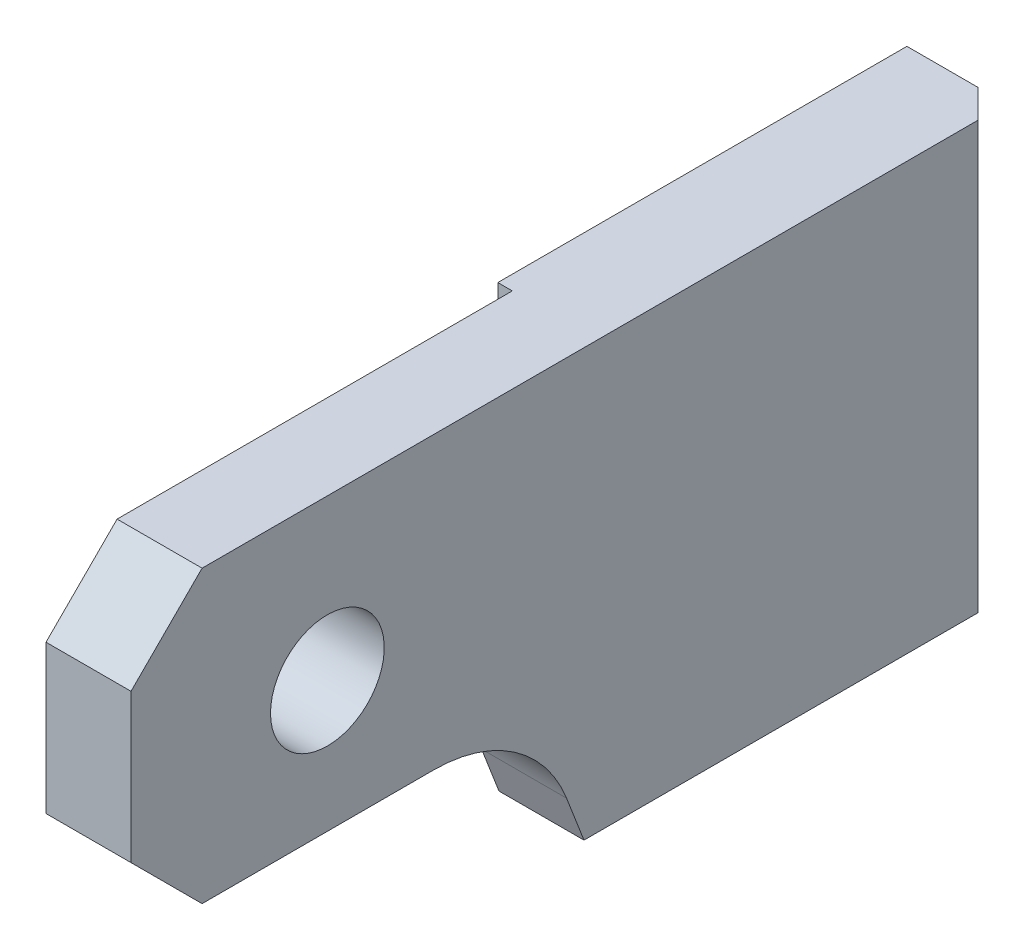
from build123d import *

# Parameters (mm, degrees)
EXTRUDE_1_DEPTH       = 7
FILLET_1_R            = 10
CHAMFER_1_SIZE        = 5
CHAMFER_2_SIZE        = 2
SKETCH_3_R            = 4
CUT_EXTRUDE_2_DEPTH   = 98.811761039
SKETCH_5_W            = 7.308921848
SKETCH_5_H            = 35.296607786
CUT_EXTRUDE_2_2_DEPTH = 98.534926302


with BuildPart() as part:
    # Эскиз1 → Вытянуть1 (new body)
    with BuildSketch(Plane(origin=(0, 0, 0), x_dir=(0, 0, -1), z_dir=(1, 0, 0))):
        Polygon((62.822655934, -30.891323454), (59.120013374, -21.327683482), (30.956731402, -21.327683482), (30.956731402, -0.888409733), (92.539330922, -0.888409733), (92.539330922, -30.896809382), align=None)
    extrude(amount=-EXTRUDE_1_DEPTH)

    # Скругление1
    fillet_1_edges = [part.edges().sort_by_distance(p)[0] for p in [
        (-3.5, -21.327683482, -59.120013374),
    ]]
    fillet(fillet_1_edges, radius=FILLET_1_R)

    # Фаска1
    chamfer_1_edges = [part.edges().sort_by_distance(p)[0] for p in [
        (-3.5, -21.327683482, -30.956731402),
        (-3.5, -0.888409733, -30.956731402),
    ]]
    chamfer(chamfer_1_edges, length=CHAMFER_1_SIZE)

    # Фаска2
    chamfer_2_edges = [part.edges().sort_by_distance(p)[0] for p in [
        (0, -15.892609557, -92.539330922),
    ]]
    chamfer(chamfer_2_edges, length=CHAMFER_2_SIZE)

    # Эскиз3 → Cut-Extrude 2 (cut, through all)
    with BuildSketch(Plane.ZY.offset(7)):
        with Locations((-44.770273228, -12.131888622)):
            Circle(SKETCH_3_R)
    extrude(amount=-CUT_EXTRUDE_2_DEPTH, mode=Mode.SUBTRACT)

    # Эскиз5 → Cut-Extrude 2 2 (cut, through all)
    with BuildSketch(Plane(origin=(0, -30.879724855, 0.005700636), x_dir=(1, 0, 0), z_dir=(0, -0.9999999829599957, 0.0001846077143906597))):
        with Locations((-9.634460924, -46.111441198)):
            Rectangle(SKETCH_5_W, SKETCH_5_H)
    extrude(amount=-CUT_EXTRUDE_2_2_DEPTH, mode=Mode.SUBTRACT)


solid = part.part
